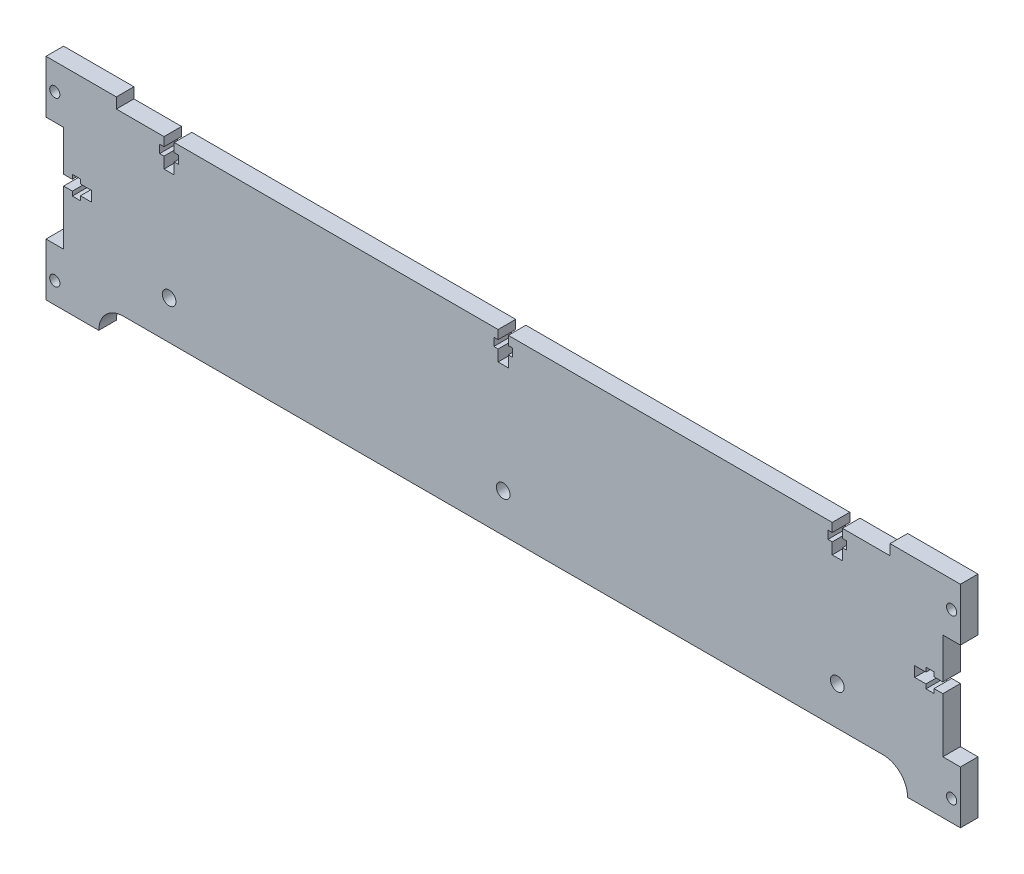
from build123d import *

# Parameters (mm, degrees)
SKETCH1_W               = 260
SKETCH1_H               = 60
BOSS_EXTRUDE1_DEPTH     = 5
SKETCH2_W               = 5
SKETCH2_H               = 30
SKETCH2_W_2             = 220
SKETCH2_H_2             = 3
CUT_EXTRUDE1_DEPTH      = 140.73546436
CUT_EXTRUDE2_DEPTH      = 140.73546436
CUT_EXTRUDE2_DEPTH_BACK = 140.73546436
SKETCH3_R               = 1.45
SKETCH3_R_2             = 1.95


with BuildPart() as part:
    # Sketch1 → Boss-Extrude1 (new body)
    with BuildSketch(Plane.XY):
        with Locations((0, 21)):
            Rectangle(SKETCH1_W, SKETCH1_H)
    extrude(amount=BOSS_EXTRUDE1_DEPTH)

    # Sketch2 → Cut-Extrude1 (cut, through all)
    with BuildSketch(Plane.XY.offset(5)):
        with Locations((-127.5, 21)):
            Rectangle(SKETCH2_W, SKETCH2_H)
        with Locations((0, 49.5)):
            Rectangle(SKETCH2_W_2, SKETCH2_H_2)
        with Locations((127.5, 21)):
            Rectangle(SKETCH2_W, SKETCH2_H)
        with BuildLine():
            Line((108, -2), (-108, -2))
            ThreePointArc((-108, -2), (-103.050252532, -4.050252532), (-101, -9))
            Line((-101, -9), (101, -9))
            ThreePointArc((101, -9), (103.050252532, -4.050252532), (108, -2))
        make_face()
        with BuildLine():
            Line((108, -9), (115, -9))
            ThreePointArc((115, -9), (112.949747468, -4.050252532), (108, -2))
            Line((108, -2), (108, -9))
        make_face()
        with BuildLine():
            Line((108, -9), (108, -2))
            ThreePointArc((108, -2), (103.050252532, -4.050252532), (101, -9))
            Line((101, -9), (108, -9))
        make_face()
        with BuildLine():
            ThreePointArc((-108, -2), (-112.949747468, -4.050252532), (-115, -9))
            Line((-115, -9), (-108, -9))
            Line((-108, -9), (-108, -2))
        make_face()
        with BuildLine():
            ThreePointArc((-101, -9), (-103.050252532, -4.050252532), (-108, -2))
            Line((-108, -2), (-108, -9))
            Line((-108, -9), (-101, -9))
        make_face()
    extrude(amount=-CUT_EXTRUDE1_DEPTH, mode=Mode.SUBTRACT)

    # Sketch3 → Cut-Extrude2 (cut, two sides: drawn at the far end of the back side and taken through both)
    with BuildSketch(Plane.XY.offset(5).offset(-CUT_EXTRUDE2_DEPTH_BACK)):
        Polygon((-96.45, 43.2), (-96.45, 40), (-93.55, 40), (-93.55, 43.2), (-92.325, 43.2), (-92.325, 45.5), (-93.55, 45.5), (-93.55, 48), (-96.45, 48), (-96.45, 45.5), (-97.675, 45.5), (-97.675, 43.2), align=None)
        Polygon((97.675, 43.2), (97.675, 45.5), (96.45, 45.5), (96.45, 48), (93.55, 48), (93.55, 45.5), (92.325, 45.5), (92.325, 43.2), (93.55, 43.2), (93.55, 40), (96.45, 40), (96.45, 43.2), align=None)
        Polygon((125, 21.55), (125, 24.45), (122.5, 24.45), (122.5, 25.675), (120.2, 25.675), (120.2, 24.45), (117, 24.45), (117, 21.55), (120.2, 21.55), (120.2, 20.325), (122.5, 20.325), (122.5, 21.55), align=None)
        Polygon((-2.675, 45.5), (-2.675, 43.2), (-1.45, 43.2), (-1.45, 40), (1.45, 40), (1.45, 43.2), (2.675, 43.2), (2.675, 45.5), (1.45, 45.5), (1.45, 48), (-1.45, 48), (-1.45, 45.5), align=None)
        Polygon((-120.2, 21.55), (-117, 21.55), (-117, 24.45), (-120.2, 24.45), (-120.2, 25.675), (-122.5, 25.675), (-122.5, 24.45), (-125, 24.45), (-125, 21.55), (-122.5, 21.55), (-122.5, 20.325), (-120.2, 20.325), align=None)
        with Locations((-127.5, 43.5)):
            Circle(SKETCH3_R)
        with Locations((-127.5, -3)):
            Circle(SKETCH3_R)
        with Locations((127.5, -3)):
            Circle(SKETCH3_R)
        with Locations((127.5, 43.5)):
            Circle(SKETCH3_R)
        with Locations((-95, 9)):
            Circle(SKETCH3_R_2)
        with Locations((95, 9)):
            Circle(SKETCH3_R_2)
        with Locations((0, 9)):
            Circle(SKETCH3_R_2)
    extrude(amount=CUT_EXTRUDE2_DEPTH + CUT_EXTRUDE2_DEPTH_BACK, mode=Mode.SUBTRACT)


solid = part.part
